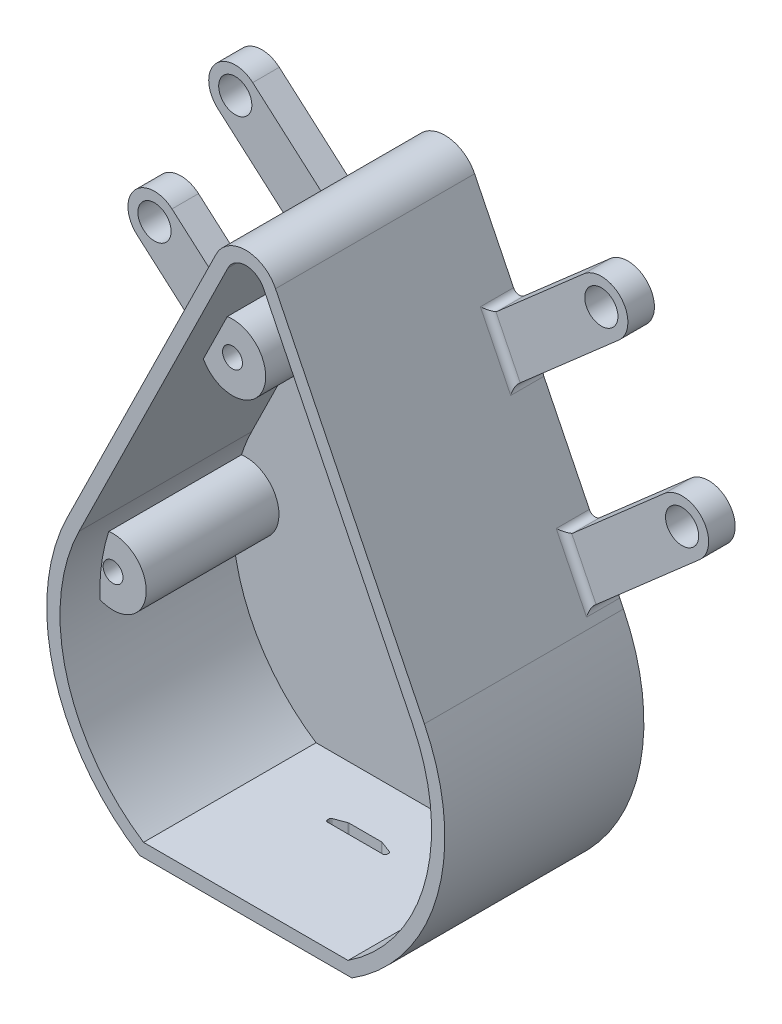
from build123d import *

# Parameters (mm, degrees)
BASE_SHELL_DEPTH         = 30
COQUE1_T                 = -2
COQUE1_THICKNESS_2_DEPTH = 2
ESQUISSE4_R              = 1.5
BOSS_EXTRU_2_DEPTH       = 24
ESQUISSE6_R              = 2.5
BOSS_EXTRU_3_DEPTH       = 4
CONG_2_R                 = 1
ENL_V_MAT_EXTRU_1_DEPTH  = 2
CONG_3_R                 = 0.3


with BuildPart() as part:
    # Esquisse2 → Base shell (new body)
    with BuildSketch(Plane.XY):
        with BuildLine():
            Line((-26.917573139, 13.245537222), (-4.48626219, 58.830434456))
            ThreePointArc((-4.48626219, 58.830434456), (0, 61.622844919), (4.48626219, 58.830434456))
            Line((4.48626219, 58.830434456), (26.917573139, 13.245537222))
            ThreePointArc((26.917573139, 13.245537222), (28.868799962, -8.160415969), (16, -25.377155081))
            Line((16, -25.377155081), (-16, -25.377155081))
            ThreePointArc((-16, -25.377155081), (-28.868799962, -8.160415969), (-26.917573139, 13.245537222))
        make_face()
    extrude(amount=BASE_SHELL_DEPTH)

    # Coque1
    coque1_openings = [part.faces().sort_by_distance(p)[0] for p in [
        (0, 9.805982993, 30),
    ]]
    offset(amount=COQUE1_T, openings=coque1_openings, kind=Kind.INTERSECTION)

    # Coque1 thickness 2 face (on inner face of the shell) → Coque1 thickness 2 (add)
    with BuildSketch(Plane(origin=(0, 9.437987549, 2), x_dir=(-1, 0, 0), z_dir=(0, 0, -1))):
        with BuildLine():
            Line((2.691757314, 48.509411092), (25.123068263, 2.924513858))
            ThreePointArc((25.123068263, 2.924513858), (27.020174162, -16.780343321), (15.411314685, -32.81514263))
            Line((15.411314685, -32.81514263), (-15.411314685, -32.81514263))
            ThreePointArc((-15.411314685, -32.81514263), (-27.020174162, -16.780343321), (-25.123068263, 2.924513858))
            Line((-25.123068263, 2.924513858), (-2.691757314, 48.509411092))
            ThreePointArc((-2.691757314, 48.509411092), (0, 50.18485737), (2.691757314, 48.509411092))
        make_face()
    extrude(amount=-COQUE1_THICKNESS_2_DEPTH)

    # Esquisse4 → Boss.-Extru.2 (add)
    # profile 1 of 4: a face of its own
    with BuildSketch(Plane.XY):
        with BuildLine():
            Line((-8.787069617, 45.560508478), (-12.392350614, 38.233858506))
            ThreePointArc((-12.392350614, 38.233858506), (-3.51373781, 38.415255382), (-8.787069617, 45.560508478))
        make_face()
        with Locations((-8, 40.622844919)):
            Circle(ESQUISSE4_R, mode=Mode.SUBTRACT)
    # profile 2 of 4: a face of its own
    with BuildSketch(Plane.XY):
        with BuildLine():
            Line((8.787069617, 45.560508478), (12.392350614, 38.233858506))
            ThreePointArc((12.392350614, 38.233858506), (3.51373781, 38.415255382), (8.787069617, 45.560508478))
        make_face()
        with Locations(Location((8, 40.622844919, 0), (0, 0, 180))):
            Circle(ESQUISSE4_R, mode=Mode.SUBTRACT)
    # profile 3 of 4: a face of its own
    with BuildSketch(Plane.XY):
        with BuildLine():
            ThreePointArc((-27.983297548, -0.966984145), (-21.047843649, 2.932810516), (-26.653016398, 8.580018467))
            ThreePointArc((-26.653016398, 8.580018467), (-27.732075565, 3.864192656), (-27.983297548, -0.966984145))
        make_face()
        with Locations((-26, 3.622844919)):
            Circle(ESQUISSE4_R, mode=Mode.SUBTRACT)
    # profile 4 of 4: a face of its own
    with BuildSketch(Plane.XY):
        with BuildLine():
            ThreePointArc((27.983297548, -0.966984145), (21.047843649, 2.932810516), (26.653016398, 8.580018467))
            ThreePointArc((26.653016398, 8.580018467), (27.732075565, 3.864192656), (27.983297548, -0.966984145))
        make_face()
        with Locations(Location((26, 3.622844919, 0), (0, 0, 180))):
            Circle(ESQUISSE4_R, mode=Mode.SUBTRACT)
    extrude(amount=BOSS_EXTRU_2_DEPTH)

    # Esquisse6 → Boss.-Extru.3 (add)
    # profile 1 of 2: a face of its own
    with BuildSketch(Plane.XY):
        with BuildLine():
            Line((0, 36.165725179), (-24.951408489, 58.009624237))
            ThreePointArc((-24.951408489, 58.009624237), (-30.595831001, 57.634798275), (-30.221005039, 51.990375763))
            Line((-30.221005039, 51.990375763), (0, 25.533168595))
            Line((0, 25.533168595), (0, 36.165725179))
        make_face()
        with Locations((-27.586206764, 55)):
            Circle(ESQUISSE6_R, mode=Mode.SUBTRACT)
    # profile 2 of 2: a face of its own
    with BuildSketch(Plane.XY):
        with BuildLine():
            Line((0, 2.938985855), (-37.122207588, 35.437902929))
            ThreePointArc((-37.122207588, 35.437902929), (-42.7666301, 35.063076966), (-42.391804138, 29.418654454))
            Line((-42.391804138, 29.418654454), (0, -7.693570729))
            Line((0, -7.693570729), (0, 2.938985855))
        make_face()
        with Locations((-39.757005863, 32.428278691)):
            Circle(ESQUISSE6_R, mode=Mode.SUBTRACT)
    boss_extru_3 = extrude(amount=BOSS_EXTRU_3_DEPTH)

    # Symétrie1: Boss.-Extru.3 across plane
    add(boss_extru_3.mirror(Plane(origin=(0, 0, 0), x_dir=(0, 0, 1), z_dir=(1, 0, 0))))

    # Congé2
    cong_2_edges = [part.edges().sort_by_distance(p)[0] for p in [
        (-14.587086989, 38.303544098, 2),
        (-10.930343207, 45.734776713, 2),
        (-24.186039417, 18.796558485, 4),
        (-22.357667526, 22.512174792, 2),
        (-26.014411308, 15.080942177, 2),
        (12.758715098, 42.019160406, 4),
        (14.587086989, 38.303544098, 2),
        (10.930343207, 45.734776713, 2),
        (24.186039417, 18.796558485, 4),
        (22.357667526, 22.512174792, 2),
        (26.014411308, 15.080942177, 2),
        (-12.758715098, 42.019160406, 4),
    ]]
    fillet(cong_2_edges, radius=CONG_2_R)

    # Esquisse8 → Enlèv. mat.-Extru.1 (cut)
    with BuildSketch(Plane.XZ.offset(25.377155081)):
        Polygon((2.5, 12), (-2.5, 12), (-4.5, 12.75), (-4.5, 13.5), (4.5, 13.5), (4.5, 12.75), align=None)
    extrude(amount=-ENL_V_MAT_EXTRU_1_DEPTH, mode=Mode.SUBTRACT)

    # Congé3
    cong_3_edges = [part.edges().sort_by_distance(p)[0] for p in [
        (2.5, -24.377155081, 12),
        (4.5, -24.377155081, 12.75),
        (4.5, -24.377155081, 13.5),
        (-4.5, -24.377155081, 13.5),
        (-4.5, -24.377155081, 12.75),
        (-2.5, -24.377155081, 12),
    ]]
    fillet(cong_3_edges, radius=CONG_3_R)


solid = part.part
